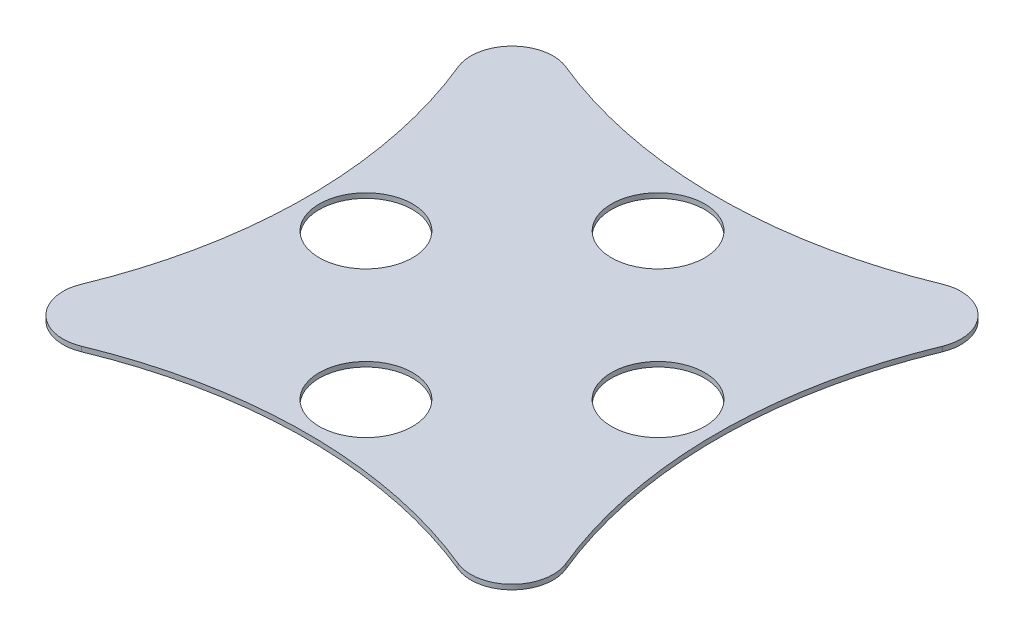
from build123d import *

# Parameters (mm, degrees)
BOSS_EXTRUDE1_DEPTH = 3
FILLET1_R           = 25.4
SKETCH3_R           = 28.75
CUT_EXTRUDE1_DEPTH  = 214.615601591
CIRPATTERN1_COUNT   = 4


with BuildPart() as part:
    # Sketch2 → Boss-Extrude1 (new body)
    with BuildSketch(Plane(origin=(0, 0, 0), x_dir=(1, 0, 0), z_dir=(0, 1, 0))):
        with BuildLine():
            ThreePointArc((212.132034356, 212.132034356), (0, 126.199665585), (-212.132034356, 212.132034356))
            ThreePointArc((-212.132034356, 212.132034356), (-126.199665585, 0), (-212.132034356, -212.132034356))
            ThreePointArc((-212.132034356, -212.132034356), (0, -126.199665585), (212.132034356, -212.132034356))
            ThreePointArc((212.132034356, -212.132034356), (126.199665585, 0), (212.132034356, 212.132034356))
        make_face()
    extrude(amount=BOSS_EXTRUDE1_DEPTH)

    # Fillet1
    fillet1_edges = [part.edges().sort_by_distance(p)[0] for p in [
        (212.132034356, 1.5, -212.132034356),
        (212.132034356, 1.5, 212.132034356),
        (-212.132034356, 1.5, -212.132034356),
        (-212.132034356, 1.5, 212.132034356),
    ]]
    fillet(fillet1_edges, radius=FILLET1_R)

    # Sketch3 → Cut-Extrude1 (cut, through all)
    with BuildSketch(Plane(origin=(0, 3, 0), x_dir=(1, 0, 0), z_dir=(0, 1, 0))):
        with Locations((90, 0)):
            Circle(SKETCH3_R)
    cut_extrude1 = extrude(amount=-CUT_EXTRUDE1_DEPTH, mode=Mode.SUBTRACT)

    # CirPattern1: Cut-Extrude1 ×4 about axis
    cirpattern1_axis = Axis((0, 3.15, 0), (0, -1, 0))
    for i in range(1, CIRPATTERN1_COUNT):
        add(cut_extrude1.rotate(cirpattern1_axis, i * 360 / CIRPATTERN1_COUNT), mode=Mode.SUBTRACT)


solid = part.part
